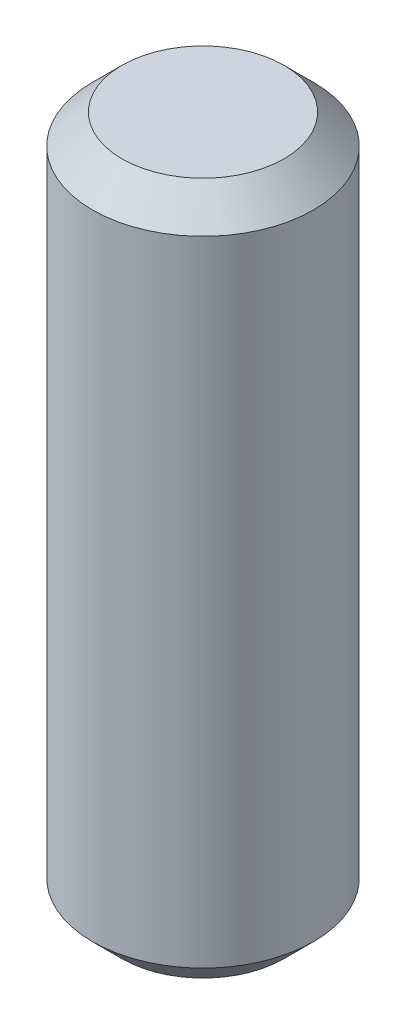
from build123d import *

# Parameters (mm, degrees)
SKETCH1_R           = 0.75
BOSS_EXTRUDE1_DEPTH = 4.7
CHAMFER1_SIZE       = 0.2


with BuildPart() as part:
    # Sketch1 → Boss-Extrude1 (new body)
    with BuildSketch(Plane(origin=(0, 0, 0), x_dir=(1, 0, 0), z_dir=(0, 1, 0))):
        with Locations(Location((0, 0, 0), (0, 0, 270))):
            Circle(SKETCH1_R)
    extrude(amount=BOSS_EXTRUDE1_DEPTH)

    # Chamfer1
    chamfer1_edges = [part.edges().sort_by_distance(p)[0] for p in [
        (0, 0, -0.75),
        (0, 4.7, -0.75),
    ]]
    chamfer(chamfer1_edges, length=CHAMFER1_SIZE)


solid = part.part
